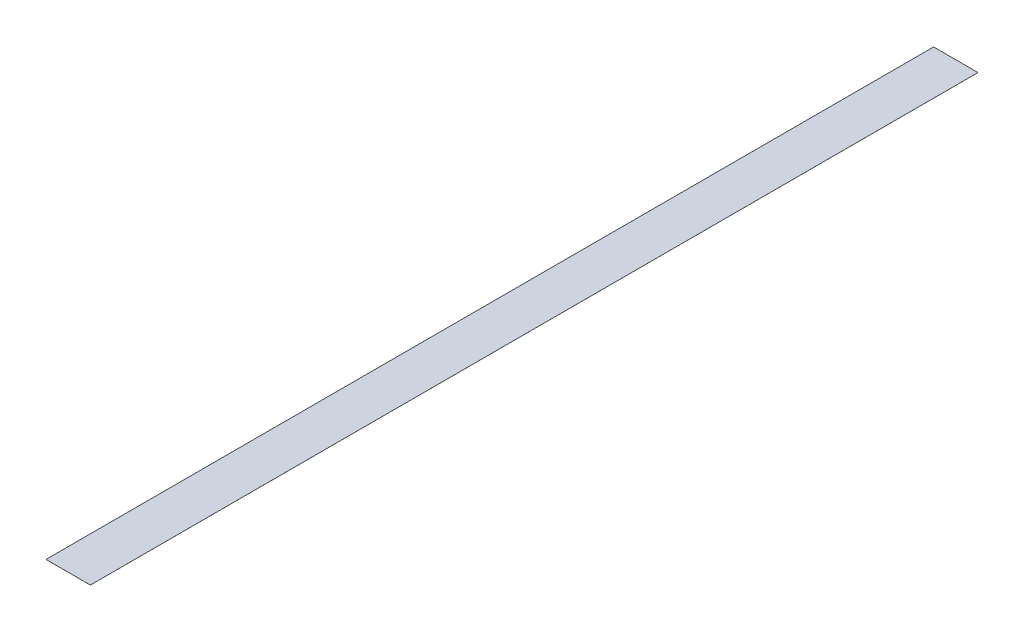
from build123d import *

# Parameters (mm, degrees)
ESBO_O1_W                 = 20
ESBO_O1_H                 = 400
RESSALTO_EXTRUS_O13_DEPTH = 0.01


with BuildPart() as part:
    # Esboço1 → Ressalto-extrusão13 (new body)
    with BuildSketch(Plane(origin=(0, 0, 0), x_dir=(1, 0, 0), z_dir=(0, 1, 0))):
        with Locations((392.129450549, 702.602186168)):
            Rectangle(ESBO_O1_W, ESBO_O1_H)
    extrude(amount=RESSALTO_EXTRUS_O13_DEPTH)


solid = part.part
